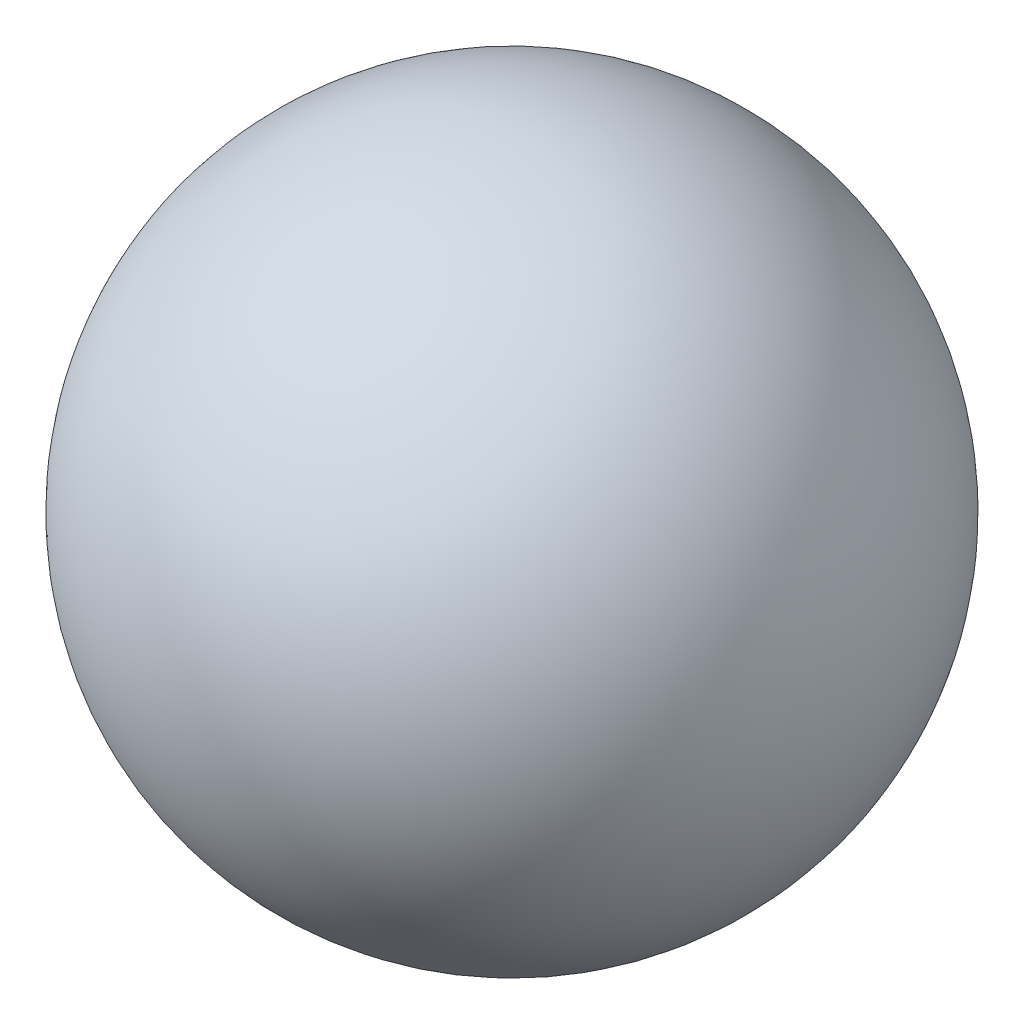
from build123d import *


with BuildPart() as part:
    # Sketch2 → Revolve2 (revolve)
    with BuildSketch(Plane.XY):
        with BuildLine():
            Line((-12, 0), (12, 0))
            ThreePointArc((12, 0), (0, -12), (-12, 0))
        make_face()
    revolve(axis=Axis((-12, 0, 0), (1, 0, 0)))


solid = part.part
